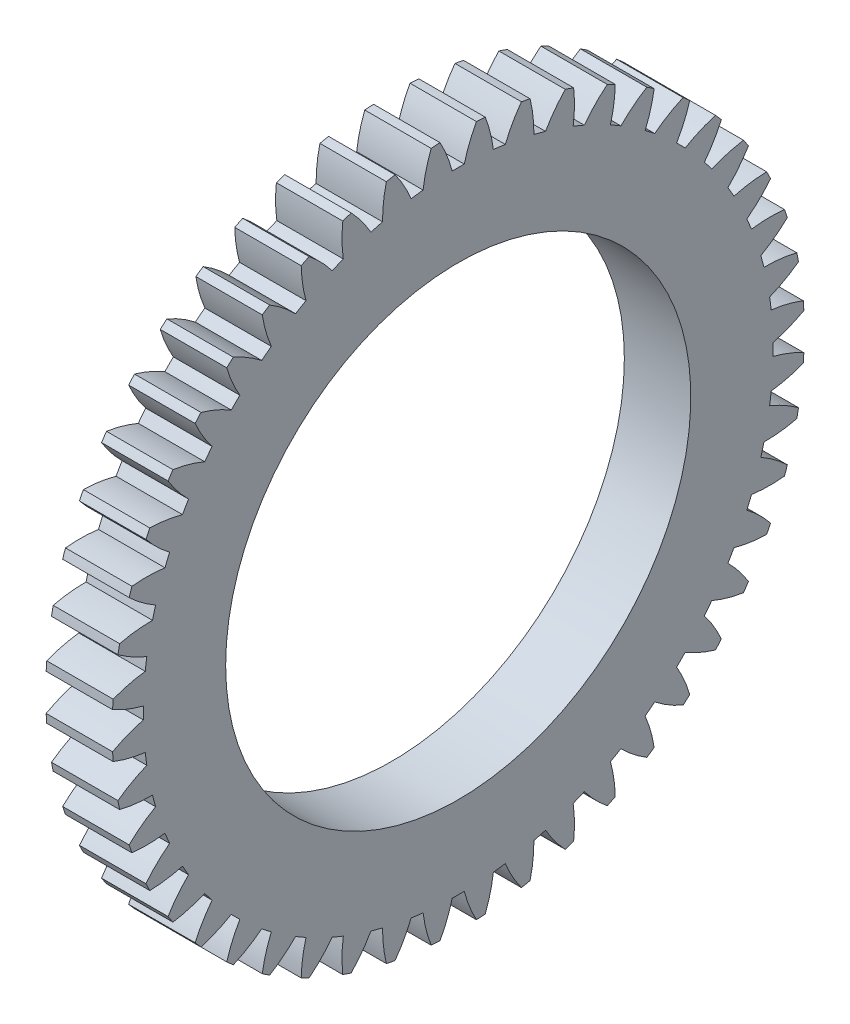
from build123d import *

# Parameters (mm, degrees)
BASPROSKE_W     = 6
BASPROSKE_H     = 31.25
TOOTHCUT_DEPTH  = 45.599607622
TEETHCUTS_COUNT = 48
TEETHCUTS_ANGLE = 352.5
BORSKE_R        = 21
BORE_DEPTH      = 50.0000508


with BuildPart() as part:
    # BasProSke → Base-Revolve (revolve)
    with BuildSketch(Plane(origin=(0, 0, 0), x_dir=(1, 0, 0), z_dir=(0, 1, 0)), mode=Mode.PRIVATE) as base_revolve_sk:
        with Locations((3, 15.625)):
            Rectangle(BASPROSKE_W, BASPROSKE_H)
    revolve(base_revolve_sk.sketch.rotate(Axis((-10, 0, 0), (1, 0, 0)), 180), axis=Axis((-10, 0, 0), (1, 0, 0)))

    # TooCutSke → ToothCut (cut, through all)
    with BuildSketch(Plane(origin=(0, 0, 0), x_dir=(0, 0, -1), z_dir=(1, 0, 0))):
        with BuildLine():
            ThreePointArc((0.545315325, 28.431270873), (0, 28.4365), (-0.545315325, 28.431270873))
            ThreePointArc((-0.545315325, 28.431270873), (-1.013949984, 29.866417699), (-1.659074458, 31.231364317))
            ThreePointArc((-1.659074458, 31.231364317), (0, 31.2754), (1.659074458, 31.231364317))
            ThreePointArc((1.659074458, 31.231364317), (1.013949984, 29.866417699), (0.545315325, 28.431270873))
        make_face()
    toothcut = extrude(amount=TOOTHCUT_DEPTH, mode=Mode.SUBTRACT)

    # TeethCuts: ToothCut ×48 about axis
    teethcuts_axis = Axis((-10, 0, 0), (1, 0, 0))
    for i in range(1, TEETHCUTS_COUNT):
        add(toothcut.rotate(teethcuts_axis, i * TEETHCUTS_ANGLE / (TEETHCUTS_COUNT - 1)), mode=Mode.SUBTRACT)

    # BorSke → Bore (cut, symmetric)
    with BuildSketch(Plane(origin=(0, 0, 0), x_dir=(0, 0, -1), z_dir=(1, 0, 0))):
        with Locations(Location((0, 0, 0), (0, 0, 180))):
            Circle(BORSKE_R)
    extrude(amount=BORE_DEPTH, both=True, mode=Mode.SUBTRACT)


solid = part.part
